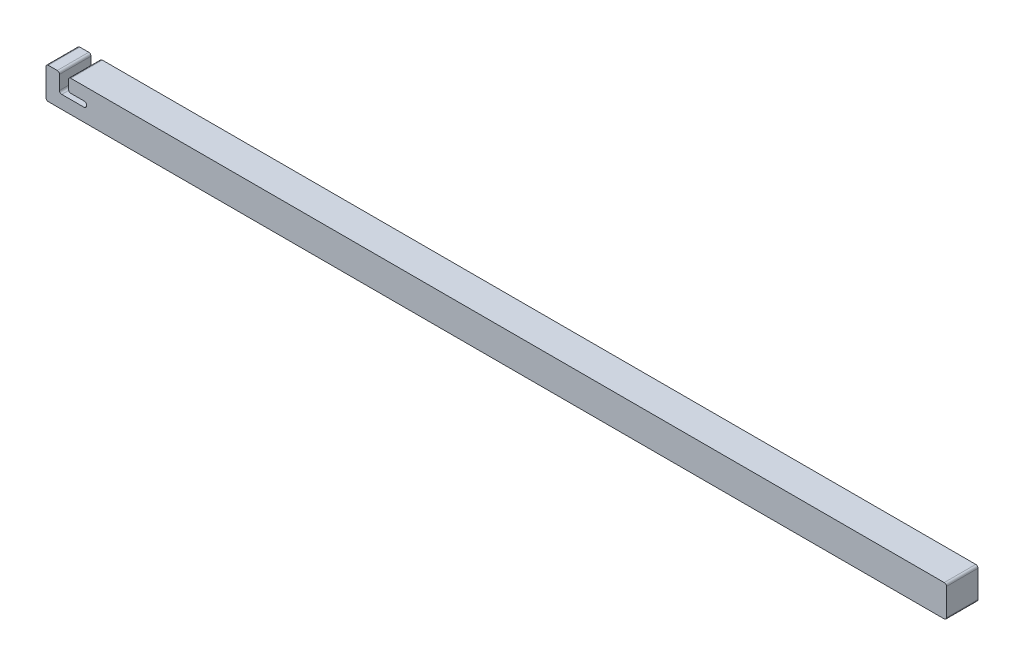
from build123d import *

# Parameters (mm, degrees)
SKETCH1_W           = 200
SKETCH1_H           = 7
BOSS_EXTRUDE1_DEPTH = 7
CUT_EXTRUDE2_DEPTH  = 101.488805347
FILLET1_R           = 0.5


with BuildPart() as part:
    # Sketch1 → Boss-Extrude1 (new body)
    with BuildSketch(Plane.XY):
        Rectangle(SKETCH1_W, SKETCH1_H)
    extrude(amount=BOSS_EXTRUDE1_DEPTH)

    # Sketch2 → Cut-Extrude2 (cut, through all)
    with BuildSketch(Plane(origin=(0, -3.5, 7), x_dir=(1, 0, 0), z_dir=(0, 0, -1))):
        Polygon((-97, -7), (-97, -2.9), (-91, -2.9), (-91, -4.1), (-95, -4.1), (-95, -7), align=None)
    extrude(amount=CUT_EXTRUDE2_DEPTH, mode=Mode.SUBTRACT)

    # Fillet1
    fillet1_edges = [part.edges().sort_by_distance(p)[0] for p in [
        (-97, 3.5, 3.5),
        (-95, 3.5, 3.5),
        (-95, 0.6, 3.5),
        (-91, 0.6, 3.5),
        (-91, -0.6, 3.5),
        (-97, -0.6, 3.5),
        (100, -3.5, 3.5),
        (-100, -3.5, 3.5),
        (-100, 3.5, 3.5),
        (100, 3.5, 3.5),
    ]]
    fillet(fillet1_edges, radius=FILLET1_R)


solid = part.part
